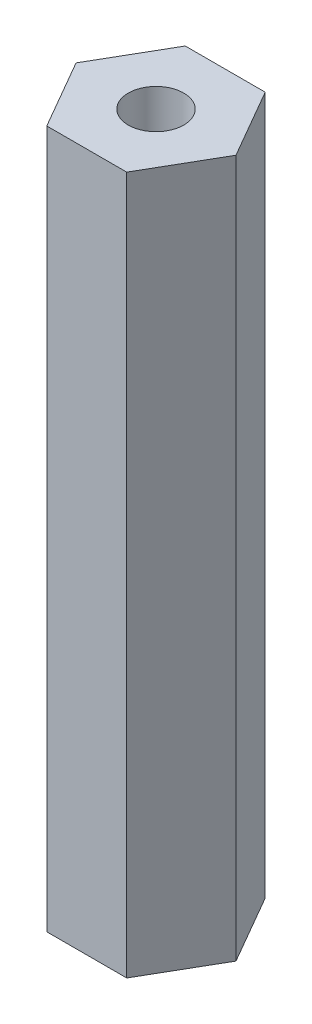
from build123d import *

# Parameters (mm, degrees)
SKETCH1_R           = 1.425
BOSS_EXTRUDE1_DEPTH = 35.84


with BuildPart() as part:
    # Sketch1 → Boss-Extrude1 (new body)
    with BuildSketch(Plane(origin=(0, 0, 0), x_dir=(1, 0, 0), z_dir=(0, 1, 0))):
        Polygon((4.106115114, 0), (2.053057557, 3.556), (-2.053057557, 3.556), (-4.106115114, 0), (-2.053057557, -3.556), (2.053057557, -3.556), align=None)
        with Locations(Location((0, 0, 0), (0, 0, 270))):
            Circle(SKETCH1_R, mode=Mode.SUBTRACT)
    extrude(amount=BOSS_EXTRUDE1_DEPTH)


solid = part.part
